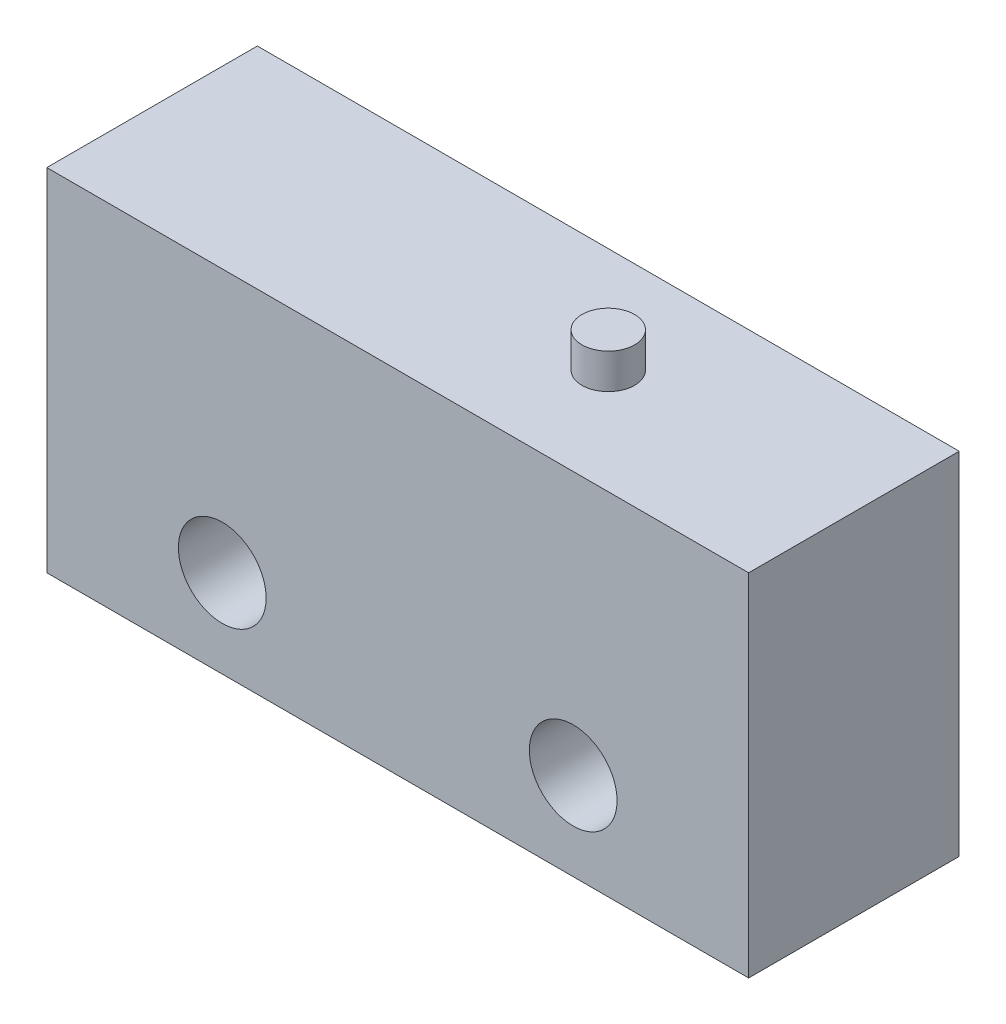
from build123d import *

# Parameters (mm, degrees)
SKETCH1_W           = 20
SKETCH1_H           = 10
SKETCH1_R           = 1.25
BOSS_EXTRUDE1_DEPTH = 6
SKETCH2_R           = 0.75
BOSS_EXTRUDE2_DEPTH = 1


with BuildPart() as part:
    # Sketch1 → Boss-Extrude1 (new body)
    with BuildSketch(Plane.XY):
        Rectangle(SKETCH1_W, SKETCH1_H)
        with Locations((-5, -2.5)):
            Circle(SKETCH1_R, mode=Mode.SUBTRACT)
        with Locations((5, -2.5)):
            Circle(SKETCH1_R, mode=Mode.SUBTRACT)
    extrude(amount=BOSS_EXTRUDE1_DEPTH)

    # Sketch2 → Boss-Extrude2 (add)
    with BuildSketch(Plane(origin=(0, 5, 0), x_dir=(1, 0, 0), z_dir=(0, 1, 0))):
        with Locations(Location((3, -3, 0), (0, 0, 90))):
            Circle(SKETCH2_R)
    extrude(amount=BOSS_EXTRUDE2_DEPTH)


solid = part.part
